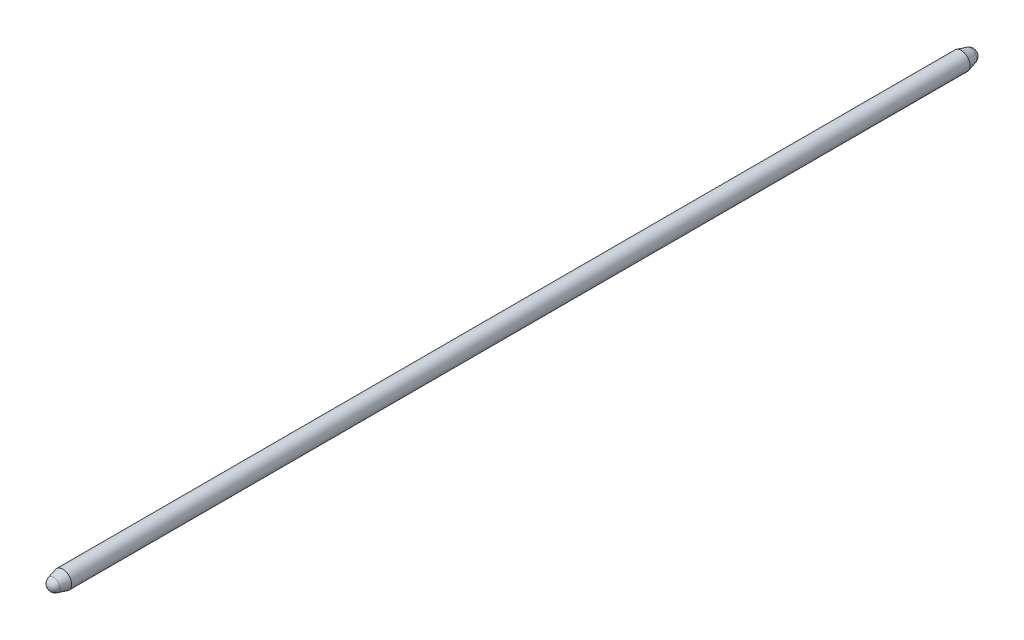
from build123d import *


with BuildPart() as part:
    # Sketch2 → Revolve1 (revolve)
    with BuildSketch(Plane(origin=(0, 0, 0), x_dir=(0, 0, -1), z_dir=(1, 0, 0))):
        with BuildLine():
            Line((1289.551605118, 25.4), (1315.672650476, 18.400886991))
            ThreePointArc((1315.672650476, 18.400886991), (1325.855528799, 11.596905223), (1329.792147667, 0))
            Line((1329.792147667, 0), (1289.551605118, 0))
            Line((1289.551605118, 0), (1289.551605118, 22.987))
            Line((1289.551605118, 22.987), (0, 22.987))
            Line((0, 22.987), (-1289.551605118, 22.987))
            Line((-1289.551605118, 22.987), (-1289.551605118, 0))
            Line((-1289.551605118, 0), (-1329.792147667, 0))
            ThreePointArc((-1329.792147667, 0), (-1325.855528799, 11.596905223), (-1315.672650476, 18.400886991))
            Line((-1315.672650476, 18.400886991), (-1289.551605118, 25.4))
            Line((-1289.551605118, 25.4), (1289.551605118, 25.4))
        make_face()
    revolve(axis=Axis((0, 0, -1329.792147667), (0, 0, 1)))


solid = part.part
